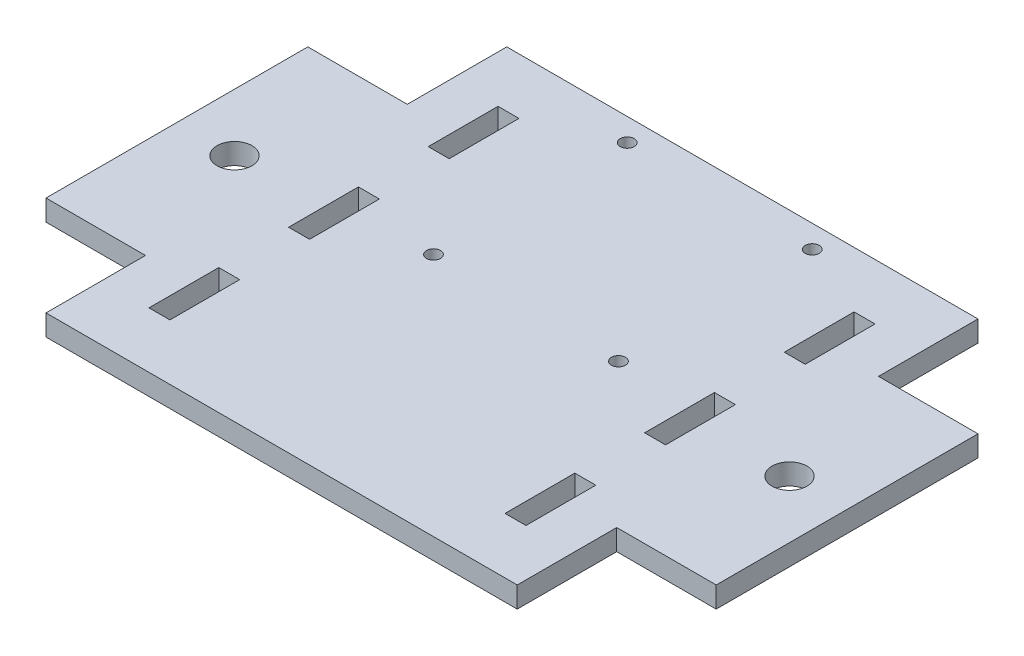
from build123d import *

# Parameters (mm, degrees)
SKETCH1_W           = 96
SKETCH1_H           = 66
SKETCH1_R           = 2.5
SKETCH1_R_2         = 1
BOSS_EXTRUDE1_DEPTH = 3
SKETCH2_W           = 14.25
SKETCH2_H           = 14.25
SKETCH2_W_2         = 3
SKETCH2_H_2         = 10
CUT_EXTRUDE1_DEPTH  = 3


with BuildPart() as part:
    # Sketch1 → Boss-Extrude1 (new body)
    with BuildSketch(Plane(origin=(0, 0, 0), x_dir=(1, 0, 0), z_dir=(0, 1, 0))):
        Rectangle(SKETCH1_W, SKETCH1_H)
        with Locations(Location((-39.75, 0, 0), (0, 0, 270))):
            Circle(SKETCH1_R, mode=Mode.SUBTRACT)
        with Locations(Location((39.75, 0, 0), (0, 0, 90))):
            Circle(SKETCH1_R, mode=Mode.SUBTRACT)
        with Locations(Location((-13.25, 29.75, 0), (0, 0, 270))):
            Circle(SKETCH1_R_2, mode=Mode.SUBTRACT)
        with Locations(Location((-13.25, 2, 0), (0, 0, 270))):
            Circle(SKETCH1_R_2, mode=Mode.SUBTRACT)
        with Locations(Location((13.25, 2, 0), (0, 0, 270))):
            Circle(SKETCH1_R_2, mode=Mode.SUBTRACT)
        with Locations(Location((13.25, 29.75, 0), (0, 0, 270))):
            Circle(SKETCH1_R_2, mode=Mode.SUBTRACT)
    extrude(amount=BOSS_EXTRUDE1_DEPTH)

    # Sketch2 → Cut-Extrude1 (cut)
    with BuildSketch(Plane(origin=(0, 3, 0), x_dir=(1, 0, 0), z_dir=(0, 1, 0))):
        with Locations((40.875, 25.875)):
            Rectangle(SKETCH2_W, SKETCH2_H)
        with Locations((-40.875, 25.875)):
            Rectangle(SKETCH2_W, SKETCH2_H)
        with Locations((40.875, -25.875)):
            Rectangle(SKETCH2_W, SKETCH2_H)
        with Locations((-40.875, -25.875)):
            Rectangle(SKETCH2_W, SKETCH2_H)
        with Locations((-25.5, -20)):
            Rectangle(SKETCH2_W_2, SKETCH2_H_2)
        with Locations((-25.5, 0)):
            Rectangle(SKETCH2_W_2, SKETCH2_H_2)
        with Locations((-25.5, 20)):
            Rectangle(SKETCH2_W_2, SKETCH2_H_2)
        with Locations((25.5, 20)):
            Rectangle(SKETCH2_W_2, SKETCH2_H_2)
        with Locations((25.5, -20)):
            Rectangle(SKETCH2_W_2, SKETCH2_H_2)
        with Locations((25.5, 0)):
            Rectangle(SKETCH2_W_2, SKETCH2_H_2)
    extrude(amount=-CUT_EXTRUDE1_DEPTH, mode=Mode.SUBTRACT)


solid = part.part
